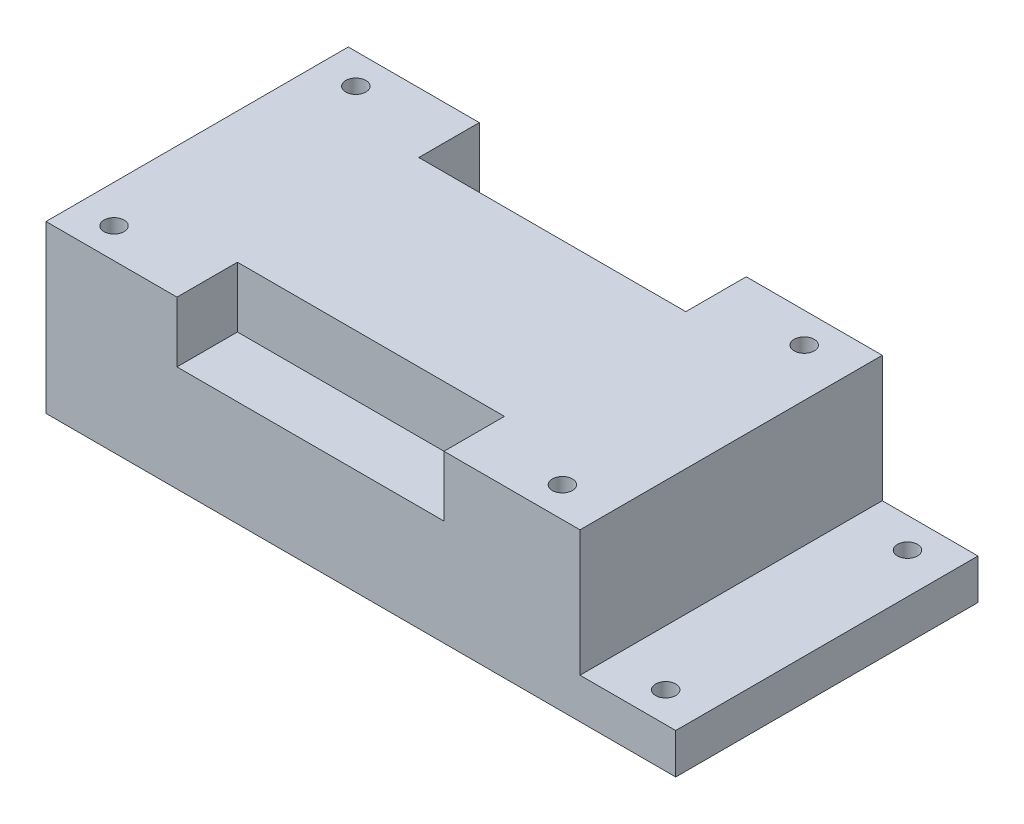
from build123d import *

# Parameters (mm, degrees)
SKETCH1_R           = 2
BOSS_EXTRUDE1_DEPTH = 33
SKETCH1_3_W         = 53
SKETCH1_3_H         = 12
BOSS_EXTRUDE2_DEPTH = 21
SKETCH1_4_W         = 19
SKETCH1_4_H         = 60
SKETCH1_4_R         = 2
BOSS_EXTRUDE3_DEPTH = 8


with BuildPart() as part:
    # Sketch1 → Boss-Extrude1 (new body)
    with BuildSketch(Plane(origin=(0, 0, 0), x_dir=(1, 0, 0), z_dir=(0, 1, 0))):
        Polygon((43.5, -30), (43.5, 30), (16.5, 30), (16.5, 18), (-36.5, 18), (-36.5, 30), (-62.5, 30), (-62.5, -30), (-36.5, -30), (-36.5, -18), (16.5, -18), (16.5, -30), align=None)
        with Locations((-55, -24)):
            Circle(SKETCH1_R, mode=Mode.SUBTRACT)
        with Locations((34, -24)):
            Circle(SKETCH1_R, mode=Mode.SUBTRACT)
        with Locations((-55, 24)):
            Circle(SKETCH1_R, mode=Mode.SUBTRACT)
        with Locations((34, 24)):
            Circle(SKETCH1_R, mode=Mode.SUBTRACT)
    extrude(amount=BOSS_EXTRUDE1_DEPTH)

    # Sketch1<3> → Boss-Extrude2 (add)
    with BuildSketch(Plane(origin=(0, 0, 0), x_dir=(1, 0, 0), z_dir=(0, 1, 0))):
        with Locations((-10, 24)):
            Rectangle(SKETCH1_3_W, SKETCH1_3_H)
        with Locations((-10, -24)):
            Rectangle(SKETCH1_3_W, SKETCH1_3_H)
    extrude(amount=BOSS_EXTRUDE2_DEPTH)

    # Sketch1<4> → Boss-Extrude3 (add)
    with BuildSketch(Plane(origin=(0, 0, 0), x_dir=(1, 0, 0), z_dir=(0, 1, 0))):
        with Locations((53, 0)):
            Rectangle(SKETCH1_4_W, SKETCH1_4_H)
        with Locations((54.5, 24)):
            Circle(SKETCH1_4_R, mode=Mode.SUBTRACT)
        with Locations((54.5, -24)):
            Circle(SKETCH1_4_R, mode=Mode.SUBTRACT)
    extrude(amount=BOSS_EXTRUDE3_DEPTH)


solid = part.part
